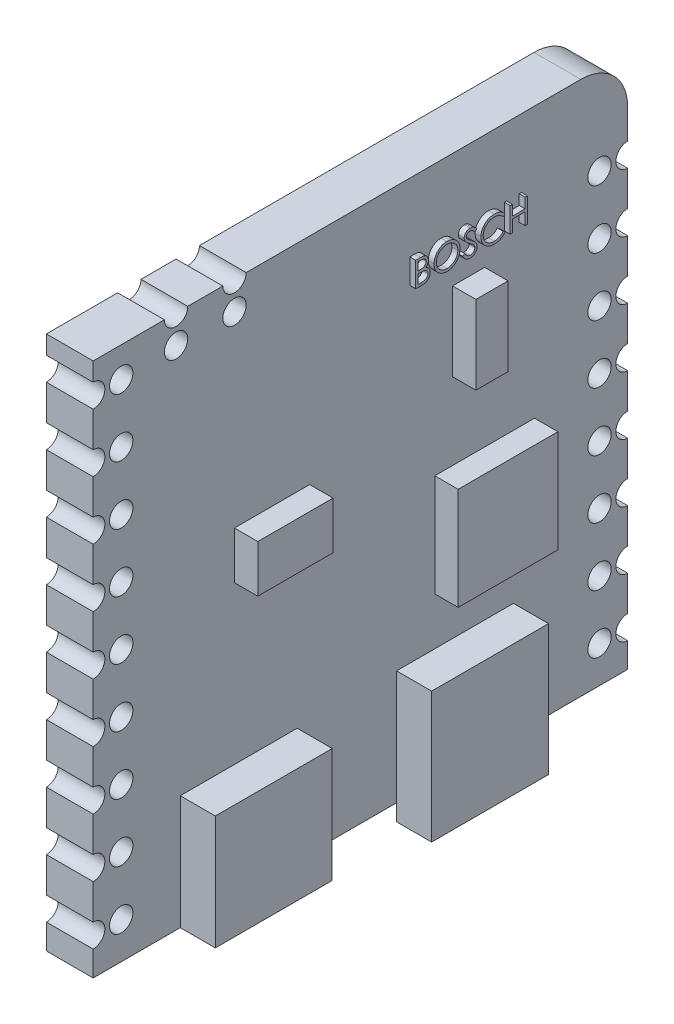
from build123d import *

# Parameters (mm, degrees)
SKETCH2_W                  = 22.86
SKETCH2_H                  = 22.86
BOSS_EXTRUDE1_DEPTH        = 2
FILLET1_R                  = 2
SKETCH3_W                  = 5
SKETCH3_H                  = 4.889030033
SKETCH3_H_2                = 5.593396903
BOSS_EXTRUDE2_DEPTH        = 1.5
SKETCH7_W                  = 0.931523596
SKETCH7_H                  = 4.114229214
CUT_EXTRUDE2_DEPTH         = 5
SKETCH8_W                  = 0.93
SKETCH8_H                  = 3.984850937
CUT_EXTRUDE3_DEPTH         = 4.3
SKETCH9_R                  = 0.5
CUT_EXTRUDE4_DEPTH         = 35.661958731
LPATTERN1_COUNT            = 9
LPATTERN1_PITCH            = 2.5
LPATTERN2_COPY_1_SKETCH_R  = 0.5
LPATTERN2_COPY_1_DEPTH     = 35.661958731
LPATTERN2_COPY_2_SKETCH_R  = 0.5
LPATTERN2_COPY_2_DEPTH     = 35.661958731
LPATTERN2_COPY_3_SKETCH_R  = 0.5
LPATTERN2_COPY_3_DEPTH     = 35.661958731
LPATTERN2_COPY_4_SKETCH_R  = 0.5
LPATTERN2_COPY_4_DEPTH     = 35.661958731
LPATTERN2_COPY_5_SKETCH_R  = 0.5
LPATTERN2_COPY_5_DEPTH     = 35.661958731
LPATTERN2_COPY_6_SKETCH_R  = 0.5
LPATTERN2_COPY_6_DEPTH     = 35.661958731
LPATTERN2_COPY_7_SKETCH_R  = 0.5
LPATTERN2_COPY_7_DEPTH     = 35.661958731
LPATTERN2_COPY_8_SKETCH_R  = 0.5
LPATTERN2_COPY_8_DEPTH     = 35.661958731
LPATTERN2_COPY_9_SKETCH_R  = 0.5
LPATTERN2_COPY_9_DEPTH     = 35.661958731
LPATTERN2_COPY_10_SKETCH_R = 0.5
LPATTERN2_COPY_10_DEPTH    = 35.661958731
LPATTERN2_COPY_11_SKETCH_R = 0.5
LPATTERN2_COPY_11_DEPTH    = 35.661958731
LPATTERN2_COPY_12_SKETCH_R = 0.5
LPATTERN2_COPY_12_DEPTH    = 35.661958731
LPATTERN2_COPY_13_SKETCH_R = 0.5
LPATTERN2_COPY_13_DEPTH    = 35.661958731
LPATTERN2_COPY_14_SKETCH_R = 0.5
LPATTERN2_COPY_14_DEPTH    = 35.661958731
SKETCH10_R                 = 0.5
CUT_EXTRUDE5_DEPTH         = 35.661958731
LPATTERN3_COUNT            = 2
LPATTERN3_PITCH            = 2.5
SKETCH11_W                 = 6.003137578
SKETCH11_H                 = 3.471694022
SKETCH11_W_2               = 1.446539176
SKETCH11_H_2               = 3.110059227
SKETCH11_W_3               = 3.290876625
SKETCH11_H_3               = 2.748424433
SKETCH11_W_4               = 2.712260955
SKETCH11_H_4               = 1.518866134
SKETCH11_H_5               = 1.012577422
SKETCH11_W_5               = 0.759433067
SKETCH11_H_6               = 1.808173969
SKETCH11_W_6               = 1.15723134
SKETCH11_H_7               = 2.35062616
SKETCH11_W_7               = 3.110059227
SKETCH11_H_8               = 1.80817397
BOSS_EXTRUDE3_DEPTH        = 1
SKETCH12_W                 = 3.218549666
SKETCH12_H                 = 2.025154846
SKETCH12_W_2               = 4.267290568
SKETCH12_H_2               = 4.375781007
SKETCH12_W_3               = 1.374212217
SKETCH12_H_3               = 3.363203583
BOSS_EXTRUDE4_DEPTH        = 1
BOSS_EXTRUDE5_DEPTH        = 0.25


with BuildPart() as part:
    # Sketch2 → Boss-Extrude1 (new body)
    with BuildSketch(Plane(origin=(0, 0, 0), x_dir=(0, 0, -1), z_dir=(1, 0, 0))):
        with Locations((11.43, -13.843927591)):
            Rectangle(SKETCH2_W, SKETCH2_H)
    extrude(amount=BOSS_EXTRUDE1_DEPTH)

    # Fillet1
    fillet1_edges = [part.edges().sort_by_distance(p)[0] for p in [
        (1, -2.413927591, -22.86),
    ]]
    fillet(fillet1_edges, radius=FILLET1_R)

    # Sketch3 → Boss-Extrude2 (add)
    with BuildSketch(Plane(origin=(2, 0, 0), x_dir=(0, 0, -1), z_dir=(1, 0, 0))):
        with Locations((6.225887284, -22.829412575)):
            Rectangle(SKETCH3_W, SKETCH3_H)
        with Locations((15.477858262, -23.18159601)):
            Rectangle(SKETCH3_W, SKETCH3_H_2)
    extrude(amount=BOSS_EXTRUDE2_DEPTH)

    # Sketch7 → Cut-Extrude2 (cut)
    with BuildSketch(Plane.XZ.offset(25.978294461)):
        with Locations((2.765761798, -15.534972869)):
            Rectangle(SKETCH7_W, SKETCH7_H)
    extrude(amount=-CUT_EXTRUDE2_DEPTH, mode=Mode.SUBTRACT)

    # Sketch8 → Cut-Extrude3 (cut)
    with BuildSketch(Plane.XZ.offset(25.273927591)):
        with Locations((2.810140075, -6.218312753)):
            Rectangle(SKETCH8_W, SKETCH8_H)
    extrude(amount=-CUT_EXTRUDE3_DEPTH, mode=Mode.SUBTRACT)

    # Sketch9 → Cut-Extrude4 (cut, through all)
    with BuildSketch(Plane(origin=(2, 0, 0), x_dir=(0, 0, -1), z_dir=(1, 0, 0))):
        with Locations((1.2, -23.704030631)):
            Circle(SKETCH9_R)
        with Locations((0, -23.704030631)):
            Circle(SKETCH9_R)
    cut_extrude4 = extrude(amount=-CUT_EXTRUDE4_DEPTH, mode=Mode.SUBTRACT)

    # LPattern1: Cut-Extrude4 ×9
    with Locations(*[(0, i * LPATTERN1_PITCH, 0) for i in range(1, LPATTERN1_COUNT)]):
        add(cut_extrude4, mode=Mode.SUBTRACT)

    # Mirror1: Cut-Extrude4 across plane
    add(cut_extrude4.mirror(Plane.XY.offset(-11.43)), mode=Mode.SUBTRACT)

    # LPattern2 copy 1 sketch → LPattern2 copy 1 (cut, through all)
    with BuildSketch(Plane(origin=(2, 2.5, -22.86), x_dir=(0, 0, 1), z_dir=(1, 0, 0))):
        with Locations((1.2, 23.704030631)):
            Circle(LPATTERN2_COPY_1_SKETCH_R)
        with Locations((0, 23.704030631)):
            Circle(LPATTERN2_COPY_1_SKETCH_R)
    extrude(amount=-LPATTERN2_COPY_1_DEPTH, mode=Mode.SUBTRACT)

    # LPattern2 copy 2 sketch → LPattern2 copy 2 (cut, through all)
    with BuildSketch(Plane(origin=(2, 5, -22.86), x_dir=(0, 0, 1), z_dir=(1, 0, 0))):
        with Locations((1.2, 23.704030631)):
            Circle(LPATTERN2_COPY_2_SKETCH_R)
        with Locations((0, 23.704030631)):
            Circle(LPATTERN2_COPY_2_SKETCH_R)
    extrude(amount=-LPATTERN2_COPY_2_DEPTH, mode=Mode.SUBTRACT)

    # LPattern2 copy 3 sketch → LPattern2 copy 3 (cut, through all)
    with BuildSketch(Plane(origin=(2, 7.5, -22.86), x_dir=(0, 0, 1), z_dir=(1, 0, 0))):
        with Locations((1.2, 23.704030631)):
            Circle(LPATTERN2_COPY_3_SKETCH_R)
        with Locations((0, 23.704030631)):
            Circle(LPATTERN2_COPY_3_SKETCH_R)
    extrude(amount=-LPATTERN2_COPY_3_DEPTH, mode=Mode.SUBTRACT)

    # LPattern2 copy 4 sketch → LPattern2 copy 4 (cut, through all)
    with BuildSketch(Plane(origin=(2, 10, -22.86), x_dir=(0, 0, 1), z_dir=(1, 0, 0))):
        with Locations((1.2, 23.704030631)):
            Circle(LPATTERN2_COPY_4_SKETCH_R)
        with Locations((0, 23.704030631)):
            Circle(LPATTERN2_COPY_4_SKETCH_R)
    extrude(amount=-LPATTERN2_COPY_4_DEPTH, mode=Mode.SUBTRACT)

    # LPattern2 copy 5 sketch → LPattern2 copy 5 (cut, through all)
    with BuildSketch(Plane(origin=(2, 12.5, -22.86), x_dir=(0, 0, 1), z_dir=(1, 0, 0))):
        with Locations((1.2, 23.704030631)):
            Circle(LPATTERN2_COPY_5_SKETCH_R)
        with Locations((0, 23.704030631)):
            Circle(LPATTERN2_COPY_5_SKETCH_R)
    extrude(amount=-LPATTERN2_COPY_5_DEPTH, mode=Mode.SUBTRACT)

    # LPattern2 copy 6 sketch → LPattern2 copy 6 (cut, through all)
    with BuildSketch(Plane(origin=(2, 15, -22.86), x_dir=(0, 0, 1), z_dir=(1, 0, 0))):
        with Locations((1.2, 23.704030631)):
            Circle(LPATTERN2_COPY_6_SKETCH_R)
        with Locations((0, 23.704030631)):
            Circle(LPATTERN2_COPY_6_SKETCH_R)
    extrude(amount=-LPATTERN2_COPY_6_DEPTH, mode=Mode.SUBTRACT)

    # LPattern2 copy 7 sketch → LPattern2 copy 7 (cut, through all)
    with BuildSketch(Plane(origin=(2, 17.5, -22.86), x_dir=(0, 0, 1), z_dir=(1, 0, 0))):
        with Locations((1.2, 23.704030631)):
            Circle(LPATTERN2_COPY_7_SKETCH_R)
        with Locations((0, 23.704030631)):
            Circle(LPATTERN2_COPY_7_SKETCH_R)
    extrude(amount=-LPATTERN2_COPY_7_DEPTH, mode=Mode.SUBTRACT)

    # LPattern2 copy 8 sketch → LPattern2 copy 8 (cut, through all)
    with BuildSketch(Plane(origin=(2, 2.5, 0), x_dir=(0, 0, -1), z_dir=(1, 0, 0))):
        with Locations((1.2, -23.704030631)):
            Circle(LPATTERN2_COPY_8_SKETCH_R)
        with Locations((0, -23.704030631)):
            Circle(LPATTERN2_COPY_8_SKETCH_R)
    extrude(amount=-LPATTERN2_COPY_8_DEPTH, mode=Mode.SUBTRACT)

    # LPattern2 copy 9 sketch → LPattern2 copy 9 (cut, through all)
    with BuildSketch(Plane(origin=(2, 5, 0), x_dir=(0, 0, -1), z_dir=(1, 0, 0))):
        with Locations((1.2, -23.704030631)):
            Circle(LPATTERN2_COPY_9_SKETCH_R)
        with Locations((0, -23.704030631)):
            Circle(LPATTERN2_COPY_9_SKETCH_R)
    extrude(amount=-LPATTERN2_COPY_9_DEPTH, mode=Mode.SUBTRACT)

    # LPattern2 copy 10 sketch → LPattern2 copy 10 (cut, through all)
    with BuildSketch(Plane(origin=(2, 7.5, 0), x_dir=(0, 0, -1), z_dir=(1, 0, 0))):
        with Locations((1.2, -23.704030631)):
            Circle(LPATTERN2_COPY_10_SKETCH_R)
        with Locations((0, -23.704030631)):
            Circle(LPATTERN2_COPY_10_SKETCH_R)
    extrude(amount=-LPATTERN2_COPY_10_DEPTH, mode=Mode.SUBTRACT)

    # LPattern2 copy 11 sketch → LPattern2 copy 11 (cut, through all)
    with BuildSketch(Plane(origin=(2, 10, 0), x_dir=(0, 0, -1), z_dir=(1, 0, 0))):
        with Locations((1.2, -23.704030631)):
            Circle(LPATTERN2_COPY_11_SKETCH_R)
        with Locations((0, -23.704030631)):
            Circle(LPATTERN2_COPY_11_SKETCH_R)
    extrude(amount=-LPATTERN2_COPY_11_DEPTH, mode=Mode.SUBTRACT)

    # LPattern2 copy 12 sketch → LPattern2 copy 12 (cut, through all)
    with BuildSketch(Plane(origin=(2, 12.5, 0), x_dir=(0, 0, -1), z_dir=(1, 0, 0))):
        with Locations((1.2, -23.704030631)):
            Circle(LPATTERN2_COPY_12_SKETCH_R)
        with Locations((0, -23.704030631)):
            Circle(LPATTERN2_COPY_12_SKETCH_R)
    extrude(amount=-LPATTERN2_COPY_12_DEPTH, mode=Mode.SUBTRACT)

    # LPattern2 copy 13 sketch → LPattern2 copy 13 (cut, through all)
    with BuildSketch(Plane(origin=(2, 15, 0), x_dir=(0, 0, -1), z_dir=(1, 0, 0))):
        with Locations((1.2, -23.704030631)):
            Circle(LPATTERN2_COPY_13_SKETCH_R)
        with Locations((0, -23.704030631)):
            Circle(LPATTERN2_COPY_13_SKETCH_R)
    extrude(amount=-LPATTERN2_COPY_13_DEPTH, mode=Mode.SUBTRACT)

    # LPattern2 copy 14 sketch → LPattern2 copy 14 (cut, through all)
    with BuildSketch(Plane(origin=(2, 17.5, 0), x_dir=(0, 0, -1), z_dir=(1, 0, 0))):
        with Locations((1.2, -23.704030631)):
            Circle(LPATTERN2_COPY_14_SKETCH_R)
        with Locations((0, -23.704030631)):
            Circle(LPATTERN2_COPY_14_SKETCH_R)
    extrude(amount=-LPATTERN2_COPY_14_DEPTH, mode=Mode.SUBTRACT)

    # Sketch10 → Cut-Extrude5 (cut, through all)
    with BuildSketch(Plane(origin=(2, 0, 0), x_dir=(0, 0, -1), z_dir=(1, 0, 0))):
        with Locations((3.546361493, -3.613927591)):
            Circle(SKETCH10_R)
        with Locations((3.546361493, -2.413927591)):
            Circle(SKETCH10_R)
    cut_extrude5 = extrude(amount=-CUT_EXTRUDE5_DEPTH, mode=Mode.SUBTRACT)

    # LPattern3: Cut-Extrude5 ×2
    with Locations(*[(0, 0, -i * LPATTERN3_PITCH) for i in range(1, LPATTERN3_COUNT)]):
        add(cut_extrude5, mode=Mode.SUBTRACT)

    # Sketch11 → Boss-Extrude3 (add)
    with BuildSketch(Plane.ZY):
        with Locations((-15.046347939, -5.477637019)):
            Rectangle(SKETCH11_W, SKETCH11_H)
        with Locations((-15.154838377, -11.408447639)):
            Rectangle(SKETCH11_W_2, SKETCH11_H_2)
        with Locations((-6.421358105, -22.438308853)):
            Rectangle(SKETCH11_W_3, SKETCH11_H_3)
        with Locations((-6.13205027, -7.647445782)):
            Rectangle(SKETCH11_W_4, SKETCH11_H_4)
        with Locations((-15.154838377, -14.771651222)):
            Rectangle(SKETCH11_W_2, SKETCH11_H_5)
        with Locations((-15.064429679, -17.520075656)):
            Rectangle(SKETCH11_W_5, SKETCH11_H_6)
        with Locations((-5.137554586, -15.440675591)):
            Rectangle(SKETCH11_W_6, SKETCH11_H_7)
        with Locations((-9.621826031, -10.504360654)):
            Rectangle(SKETCH11_W_7, SKETCH11_H_8)
    extrude(amount=BOSS_EXTRUDE3_DEPTH)

    # Sketch12 → Boss-Extrude4 (add)
    with BuildSketch(Plane(origin=(2, 0, 0), x_dir=(0, 0, -1), z_dir=(1, 0, 0))):
        with Locations((7.650916404, -12.638005938)):
            Rectangle(SKETCH12_W, SKETCH12_H)
        with Locations((16.74603147, -16.163945179)):
            Rectangle(SKETCH12_W_2, SKETCH12_H_2)
        with Locations((16.058925362, -9.00357626)):
            Rectangle(SKETCH12_W_3, SKETCH12_H_3)
    extrude(amount=BOSS_EXTRUDE4_DEPTH)

    # Sketch13 → Boss-Extrude5 (add)
    # profile 1 of 5: a face of its own
    with BuildSketch(Plane(origin=(2, 0, 0), x_dir=(0, 0, -1), z_dir=(1, 0, 0))):
        with BuildLine():
            Line((13.544549353, -5.333516444), (13.751043076, -5.333516444))
            add(Edge.make_bspline(
                [(13.751043076, -5.333516444), (13.761151211, -5.333569588), (13.780743293, -5.333672594), (13.809233457, -5.335270112), (13.835918217, -5.337448364), (13.86080531, -5.340904607), (13.883883236, -5.345074977), (13.905221546, -5.350125288), (13.924752384, -5.356180955), (13.948069806, -5.365810664), (13.974655339, -5.380120288), (14.00344152, -5.401265355), (14.028056611, -5.427128742), (14.049279617, -5.456303259), (14.066152813, -5.488396695), (14.078359719, -5.522644117), (14.086087934, -5.558603786), (14.086882722, -5.583291128), (14.087284396, -5.595767713)],
                knots=[0, 0, 0, 0, 1.001505555, 1.941167018, 2.826882275, 3.653841531, 4.429895133, 5.150066043, 5.825578002, 6.45369114, 7.647487171, 8.808567382, 9.977351308, 11.170798116, 12.373658725, 13.556498008, 14.765093433, 16, 16, 16, 16], degree=3))
            add(Edge.make_bspline(
                [(14.087284396, -5.595767713), (14.086953827, -5.60745551), (14.086304229, -5.630423132), (14.08009249, -5.664015875), (14.070367716, -5.695993029), (14.056849701, -5.726237893), (14.039280764, -5.754067105), (14.01845932, -5.779705159), (13.993338477, -5.80206655), (13.974517307, -5.814567856), (13.964957005, -5.820917954)],
                knots=[0, 0, 0, 0, 1.044552857, 2.05264487, 3.044412934, 4.028983338, 5.005914585, 5.980388656, 6.974128949, 8, 8, 8, 8], degree=3))
            add(Edge.make_bspline(
                [(13.964957005, -5.820917954), (13.976979801, -5.825533798), (13.999982388, -5.834365053), (14.031637444, -5.849978634), (14.058910647, -5.866960986), (14.082011689, -5.88550657), (14.101768551, -5.905496615), (14.119020274, -5.927224233), (14.133740594, -5.950972857), (14.146353788, -5.976494879), (14.156195912, -6.003529692), (14.163566721, -6.031823712), (14.167790212, -6.061275482), (14.168391237, -6.081318918), (14.168694652, -6.091437451)],
                knots=[0, 0, 0, 0, 1.27268992, 2.434971085, 3.483601985, 4.442670788, 5.356604649, 6.2567628, 7.179492994, 8.113709626, 9.066344395, 10.018646069, 10.999752585, 12, 12, 12, 12], degree=3))
            add(Edge.make_bspline(
                [(14.168694652, -6.091437451), (14.168399272, -6.101768863), (14.167818105, -6.122096204), (14.163530351, -6.151957876), (14.156270455, -6.180495062), (14.14627037, -6.207892343), (14.133218908, -6.234096717), (14.117335452, -6.259137871), (14.09839686, -6.282764204), (14.077211183, -6.305238252), (14.05324382, -6.325445702), (14.027385485, -6.343442118), (13.999310526, -6.358242475), (13.969480042, -6.370675177), (13.937559404, -6.380172115), (13.903691949, -6.386816203), (13.867906886, -6.391292964), (13.843350604, -6.391661024), (13.830757286, -6.391849778)],
                knots=[0, 0, 0, 0, 0.978564426, 1.925352924, 2.850884081, 3.763762016, 4.682927383, 5.618979971, 6.567305752, 7.547517671, 8.540179244, 9.531824382, 10.526200242, 11.540722885, 12.589160233, 13.674978461, 14.80764778, 16, 16, 16, 16], degree=3))
            Line((13.830757286, -6.391849778), (13.544549353, -6.391849778))
            Line((13.544549353, -6.391849778), (13.544549353, -5.333516444))
        make_face()
        with BuildLine():
            Line((13.639527985, -5.442063453), (13.639527985, -5.781272855))
            Line((13.639527985, -5.781272855), (13.703341754, -5.781272855))
            add(Edge.make_bspline(
                [(13.703341754, -5.781272855), (13.712669842, -5.781151926), (13.730693609, -5.780918266), (13.756795102, -5.780248941), (13.781023381, -5.77837477), (13.803336626, -5.776501139), (13.823699698, -5.773454775), (13.842067485, -5.769828586), (13.858728251, -5.765993517), (13.8779414, -5.759471315), (13.899734886, -5.749832113), (13.922967754, -5.734872772), (13.943449367, -5.71705517), (13.960744707, -5.696495998), (13.974899604, -5.67385789), (13.984731132, -5.649502047), (13.991397811, -5.624035484), (13.992000012, -5.606552345), (13.992305763, -5.597675766)],
                knots=[0, 0, 0, 0, 1.156816544, 2.235205308, 3.236616184, 4.169592532, 5.011045266, 5.787822928, 6.49130361, 7.128639758, 8.301311294, 9.436451833, 10.541879658, 11.654887649, 12.756523258, 13.837046038, 14.901820046, 16, 16, 16, 16], degree=3))
            add(Edge.make_bspline(
                [(13.992305763, -5.597675766), (13.992146656, -5.591801783), (13.991834551, -5.580279323), (13.989278433, -5.563482256), (13.984933952, -5.547684741), (13.979353725, -5.532670284), (13.971555717, -5.518908367), (13.962374384, -5.505923163), (13.95128133, -5.494156879), (13.938654714, -5.483159436), (13.924137821, -5.473409305), (13.907739312, -5.464869836), (13.889237324, -5.457993458), (13.868943675, -5.451971193), (13.846545989, -5.447741399), (13.822302731, -5.444217637), (13.796015328, -5.442423689), (13.777828594, -5.44218621), (13.768427558, -5.442063453)],
                knots=[0, 0, 0, 0, 0.91205012, 1.789085906, 2.630437955, 3.453916878, 4.269457761, 5.079663411, 5.91843418, 6.774407191, 7.675494373, 8.627863946, 9.638891023, 10.736472738, 11.911756761, 13.175263542, 14.539845004, 16, 16, 16, 16], degree=3))
            Line((13.768427558, -5.442063453), (13.639527985, -5.442063453))
        make_face(mode=Mode.SUBTRACT)
        with BuildLine():
            Line((13.639527985, -5.889819863), (13.639527985, -6.283302769))
            Line((13.639527985, -6.283302769), (13.774787734, -6.283302769))
            add(Edge.make_bspline(
                [(13.774787734, -6.283302769), (13.784469648, -6.283186731), (13.803130259, -6.282963084), (13.830072774, -6.282232968), (13.855044332, -6.280572209), (13.877930982, -6.277957868), (13.898979857, -6.275122004), (13.917938448, -6.271308593), (13.934960438, -6.266939502), (13.954698145, -6.260186074), (13.976924206, -6.249694522), (14.00087606, -6.233875697), (14.022171607, -6.215030316), (14.040255578, -6.193219301), (14.055076172, -6.169503162), (14.065857703, -6.144361592), (14.072507319, -6.118210015), (14.073312308, -6.100379605), (14.07371602, -6.091437451)],
                knots=[0, 0, 0, 0, 1.160039823, 2.235823828, 3.228722157, 4.157150951, 4.99529583, 5.772374946, 6.472645482, 7.099169577, 8.269452708, 9.405989375, 10.527446681, 11.663510218, 12.788923519, 13.866172445, 14.929861265, 16, 16, 16, 16], degree=3))
            add(Edge.make_bspline(
                [(14.07371602, -6.091437451), (14.073632531, -6.085845417), (14.0734669, -6.07475155), (14.070969048, -6.058448433), (14.067336282, -6.042656324), (14.062639872, -6.02733234), (14.055800176, -6.012753534), (14.04781534, -5.998631569), (14.038453202, -5.984947779), (14.023865085, -5.967647883), (14.002646414, -5.947715834), (13.972496984, -5.928200923), (13.938215361, -5.912462657), (13.913351333, -5.905780196), (13.900507219, -5.90232821)],
                knots=[0, 0, 0, 0, 0.723448775, 1.435228256, 2.130040452, 2.821711965, 3.505591119, 4.210454504, 4.921174351, 5.648778258, 7.137944449, 8.670945889, 10.280296675, 12, 12, 12, 12], degree=3))
            add(Edge.make_bspline(
                [(13.900507219, -5.90232821), (13.895357945, -5.901283458), (13.884193256, -5.899018221), (13.86598763, -5.896627083), (13.845203213, -5.894496791), (13.82179201, -5.892921036), (13.7957244, -5.891292248), (13.766944713, -5.890658814), (13.735570478, -5.889903085), (13.713801355, -5.889848313), (13.702493731, -5.889819863)],
                knots=[0, 0, 0, 0, 0.634451884, 1.375622551, 2.216452059, 3.157844607, 4.20941857, 5.370758133, 6.634282058, 8, 8, 8, 8], degree=3))
            Line((13.702493731, -5.889819863), (13.639527985, -5.889819863))
        make_face(mode=Mode.SUBTRACT)
    # profile 2 of 5: a face of its own
    with BuildSketch(Plane(origin=(2, 0, 0), x_dir=(0, 0, -1), z_dir=(1, 0, 0))):
        with BuildLine():
            add(Edge.make_bspline(
                [(14.881034396, -5.306379692), (14.900631132, -5.306876044), (14.93912074, -5.307850921), (14.995688626, -5.315313412), (15.049692381, -5.328223684), (15.101571923, -5.345417967), (15.150706704, -5.368354888), (15.19746656, -5.396078731), (15.241740233, -5.428879946), (15.282930984, -5.466504974), (15.320624872, -5.507442352), (15.353834128, -5.55112972), (15.381665964, -5.597302929), (15.404521667, -5.645823228), (15.422452437, -5.696580885), (15.434825576, -5.7498465), (15.442729255, -5.805274951), (15.443653264, -5.843080694), (15.444122002, -5.862259099)],
                knots=[0, 0, 0, 0, 1.065120563, 2.091984664, 3.0946048, 4.079830382, 5.057816894, 6.036188127, 7.030412546, 8.04752943, 9.064399622, 10.05169764, 11.02544977, 11.989514704, 12.962713494, 13.945757189, 14.957906945, 16, 16, 16, 16], degree=3))
            add(Edge.make_bspline(
                [(15.444122002, -5.862259099), (15.443653332, -5.881296232), (15.442729529, -5.918820626), (15.43481659, -5.973897334), (15.422406573, -6.026841425), (15.404688178, -6.077564516), (15.381941426, -6.126120112), (15.353924267, -6.172380453), (15.320922044, -6.216360704), (15.283364258, -6.257579057), (15.242421562, -6.295375912), (15.198506696, -6.328310905), (15.152607287, -6.356651295), (15.104132685, -6.379264454), (15.053725769, -6.397338344), (15.0009354, -6.409661163), (14.946008942, -6.417609864), (14.90855271, -6.418522606), (14.889514631, -6.41898653)],
                knots=[0, 0, 0, 0, 1.043624062, 2.057103931, 3.04512605, 4.022047818, 4.998200453, 5.980619268, 6.982898556, 8.009068085, 9.034988726, 10.034168286, 11.015286542, 11.987931943, 12.962482838, 13.94673481, 14.956375938, 16, 16, 16, 16], degree=3))
            add(Edge.make_bspline(
                [(14.889514631, -6.41898653), (14.870336325, -6.418518025), (14.832530778, -6.417594477), (14.777032675, -6.409677719), (14.723729643, -6.397297848), (14.672774113, -6.379605709), (14.62413767, -6.356740499), (14.577725192, -6.328859651), (14.533722974, -6.295777015), (14.492495827, -6.258231408), (14.454774046, -6.217358106), (14.421887282, -6.173562986), (14.394000164, -6.127705264), (14.371211728, -6.07965768), (14.353170332, -6.029652505), (14.34086197, -5.97735618), (14.33289848, -5.923066853), (14.3319808, -5.886102929), (14.331515165, -5.86734724)],
                knots=[0, 0, 0, 0, 1.053102029, 2.075944431, 3.073151272, 4.055350789, 5.033113405, 6.020478099, 7.024410459, 8.052272461, 9.079885166, 10.07527673, 11.055994387, 12.023226415, 12.992069828, 13.970394897, 14.97016774, 16, 16, 16, 16], degree=3))
            add(Edge.make_bspline(
                [(14.331515165, -5.86734724), (14.331676828, -5.854758314), (14.331998116, -5.829739277), (14.33586608, -5.792586757), (14.341478785, -5.756031725), (14.349522697, -5.720178129), (14.360043034, -5.685113736), (14.372456385, -5.65059672), (14.38761772, -5.616976879), (14.404756868, -5.584094949), (14.423886034, -5.552463511), (14.445015129, -5.522564208), (14.467402015, -5.494146145), (14.491944279, -5.467945741), (14.517833061, -5.443200802), (14.545488333, -5.4202916), (14.574741345, -5.399011555), (14.605717969, -5.379834452), (14.637654923, -5.362490142), (14.670577187, -5.347606392), (14.704037627, -5.334831988), (14.738192961, -5.324478214), (14.772952489, -5.316304242), (14.808392077, -5.310738209), (14.844483489, -5.306860379), (14.86879834, -5.306540611), (14.881034396, -5.306379692)],
                knots=[0, 0, 0, 0, 1.037015668, 2.060948919, 3.074880161, 4.083647147, 5.086022904, 6.090072063, 7.104153813, 8.122640571, 9.144368836, 10.147691507, 11.138137339, 12.123020368, 13.103399296, 14.087645067, 15.080126199, 16.082011238, 17.087798457, 18.072939717, 19.057185487, 20.037253025, 21.01195951, 21.997135196, 22.992090687, 24, 24, 24, 24], degree=3))
        make_face()
        with BuildLine():
            add(Edge.make_bspline(
                [(14.885698525, -5.414926701), (14.875655052, -5.415049132), (14.855664124, -5.415292824), (14.825944752, -5.418502814), (14.796616239, -5.423077804), (14.767672527, -5.429603645), (14.73923472, -5.43849487), (14.711037744, -5.448727716), (14.683338726, -5.461192189), (14.656229107, -5.475274888), (14.629947644, -5.4908623), (14.605148565, -5.508089477), (14.58176767, -5.526552421), (14.559862206, -5.546294219), (14.539496495, -5.567415408), (14.520269692, -5.589595788), (14.502952461, -5.613469336), (14.487081823, -5.638388673), (14.472879642, -5.664321342), (14.460250595, -5.690994324), (14.449920049, -5.718625196), (14.441494997, -5.746914191), (14.434510054, -5.775816506), (14.430085034, -5.805551394), (14.426839773, -5.835969439), (14.426610011, -5.856525857), (14.426493797, -5.866923229)],
                knots=[0, 0, 0, 0, 1.008559885, 2.007477868, 2.99961109, 3.989939068, 4.984837346, 5.991145699, 7.001802488, 8.033829008, 9.059044045, 10.069351652, 11.065060232, 12.050310815, 13.029377138, 14.011219647, 14.996725999, 15.989392538, 16.977580475, 17.965360261, 18.951710183, 19.937753436, 20.929683414, 21.935841486, 22.955955122, 24, 24, 24, 24], degree=3))
            add(Edge.make_bspline(
                [(14.426493797, -5.866923229), (14.426879291, -5.882212281), (14.427637677, -5.912290577), (14.434277228, -5.956368087), (14.444504349, -5.998728117), (14.459580267, -6.039138885), (14.478433905, -6.077947751), (14.50172537, -6.11481044), (14.529320379, -6.149736914), (14.560666255, -6.18248334), (14.594932883, -6.212372429), (14.631319208, -6.238608031), (14.669435418, -6.260805892), (14.70938091, -6.278889807), (14.750942428, -6.293219561), (14.794387783, -6.30304048), (14.839427565, -6.309504011), (14.870128501, -6.310124725), (14.885698525, -6.310439521)],
                knots=[0, 0, 0, 0, 1.032063989, 2.030389145, 3.003944642, 3.970395727, 4.937377036, 5.913328081, 6.909231446, 7.93887556, 8.970685674, 9.976071282, 10.964166581, 11.944589148, 12.933237628, 13.927779006, 14.949070134, 16, 16, 16, 16], degree=3))
            add(Edge.make_bspline(
                [(14.885698525, -6.310439521), (14.896163779, -6.310295738), (14.916919521, -6.310010572), (14.947791262, -6.307138353), (14.978106831, -6.302532526), (15.007823706, -6.295901113), (15.036908161, -6.287601601), (15.06548159, -6.277741645), (15.093239644, -6.265440424), (15.1205325, -6.25184902), (15.146657078, -6.236354972), (15.171596108, -6.219712484), (15.194720987, -6.201276734), (15.216610064, -6.181828253), (15.237059389, -6.160974899), (15.255930677, -6.138743784), (15.273160383, -6.114994586), (15.289024995, -6.090113046), (15.303177411, -6.064109417), (15.315508233, -6.037339729), (15.32596944, -6.009869898), (15.334414488, -5.981660304), (15.341032234, -5.952764524), (15.345592115, -5.923143867), (15.348781762, -5.892857589), (15.349022178, -5.872373138), (15.34914337, -5.862047093)],
                knots=[0, 0, 0, 0, 1.047197238, 2.076906641, 3.100256066, 4.114471768, 5.12198147, 6.126382909, 7.136867548, 8.15857795, 9.17633901, 10.174870724, 11.156907918, 12.133735059, 13.104061851, 14.077631395, 15.04955518, 16.038496417, 17.029181396, 18.010275684, 18.986308667, 19.968651475, 20.955262928, 21.950658345, 22.966943676, 24, 24, 24, 24], degree=3))
            add(Edge.make_bspline(
                [(15.34914337, -5.862047093), (15.349022081, -5.851791691), (15.348781482, -5.831448211), (15.345593639, -5.801373154), (15.341027417, -5.771965635), (15.334446789, -5.743341104), (15.325964956, -5.715492265), (15.315506407, -5.688445272), (15.303173709, -5.662099365), (15.289019793, -5.636519661), (15.273109771, -5.611973967), (15.255724606, -5.588508475), (15.236564132, -5.566563861), (15.216175787, -5.54559837), (15.194050305, -5.526059151), (15.170287911, -5.507939722), (15.145177085, -5.490802803), (15.118589563, -5.475343407), (15.09115032, -5.461066723), (15.062994433, -5.44883511), (15.034440872, -5.438441636), (15.005562247, -5.429576744), (14.97611549, -5.423103363), (14.94629957, -5.418498691), (14.916155739, -5.415293941), (14.895883147, -5.415049503), (14.885698525, -5.414926701)],
                knots=[0, 0, 0, 0, 1.02996197, 2.043119294, 3.035359645, 4.018872909, 4.991431989, 5.957985074, 6.929999688, 7.912076566, 8.892894881, 9.867085534, 10.843653904, 11.817741046, 12.803660682, 13.806313499, 14.818574707, 15.856120519, 16.894564902, 17.924820532, 18.937903209, 19.946497019, 20.957711757, 21.963978472, 22.977135795, 24, 24, 24, 24], degree=3))
        make_face(mode=Mode.SUBTRACT)
    # profile 3 of 5: a face of its own
    with BuildSketch(Plane(origin=(2, 0, 0), x_dir=(0, 0, -1), z_dir=(1, 0, 0))):
        with BuildLine():
            Line((15.552669011, -6.187688119), (15.642135491, -6.134050632))
            add(Edge.make_bspline(
                [(15.642135491, -6.134050632), (15.650456481, -6.147979625), (15.666399179, -6.174667037), (15.692993994, -6.210728397), (15.720550851, -6.241378383), (15.749273816, -6.26643869), (15.778987567, -6.286168711), (15.809886079, -6.300139386), (15.841865226, -6.308852788), (15.863628739, -6.309911147), (15.874493931, -6.310439521)],
                knots=[0, 0, 0, 0, 1.272034388, 2.437168799, 3.508375237, 4.49857839, 5.41946034, 6.295179144, 7.148887113, 8, 8, 8, 8], degree=3))
            add(Edge.make_bspline(
                [(15.874493931, -6.310439521), (15.883773053, -6.310181085), (15.902168934, -6.309668733), (15.929250851, -6.304745729), (15.955552491, -6.297182538), (15.980531769, -6.28635097), (16.003844015, -6.273246238), (16.024286992, -6.257417751), (16.041959983, -6.23969635), (16.056416549, -6.219925881), (16.067507893, -6.198663315), (16.076032637, -6.176838682), (16.080763409, -6.154109138), (16.081476047, -6.138805498), (16.081835678, -6.13108255)],
                knots=[0, 0, 0, 0, 1.095163259, 2.171163733, 3.241058638, 4.321873601, 5.38011039, 6.391990106, 7.366004449, 8.327778327, 9.272591725, 10.192022065, 11.087607919, 12, 12, 12, 12], degree=3))
            add(Edge.make_bspline(
                [(16.081835678, -6.13108255), (16.081389874, -6.122270912), (16.080483621, -6.10435814), (16.072823864, -6.07793015), (16.060774211, -6.051776444), (16.049657887, -6.035598681), (16.043886626, -6.027199671)],
                knots=[0, 0, 0, 0, 0.938893495, 1.908633276, 2.914225137, 4, 4, 4, 4], degree=3))
            add(Edge.make_bspline(
                [(16.043886626, -6.027199671), (16.039148131, -6.021137893), (16.029200253, -6.008411949), (16.012098338, -5.989469224), (15.992030489, -5.969929844), (15.969683462, -5.949047701), (15.944243218, -5.92779401), (15.916506565, -5.905155269), (15.885765351, -5.881992411), (15.864205741, -5.866458326), (15.853081337, -5.858442994)],
                knots=[0, 0, 0, 0, 0.722233717, 1.516239348, 2.393582979, 3.351407094, 4.387010283, 5.505090956, 6.712668013, 8, 8, 8, 8], degree=3))
            add(Edge.make_bspline(
                [(15.853081337, -5.858442994), (15.841946462, -5.850511968), (15.820657429, -5.835348452), (15.790885429, -5.812843966), (15.764262461, -5.792268796), (15.740906853, -5.773429249), (15.72082888, -5.756322771), (15.703870325, -5.741113633), (15.69046319, -5.727390508), (15.683007812, -5.718488007), (15.679660531, -5.714491004)],
                knots=[0, 0, 0, 0, 1.452282411, 2.77665338, 3.964542531, 5.026858415, 5.96415736, 6.766646006, 7.446254459, 8, 8, 8, 8], degree=3))
            add(Edge.make_bspline(
                [(15.679660531, -5.714491004), (15.674981928, -5.708261643), (15.665780827, -5.696010768), (15.653635392, -5.676862537), (15.64331236, -5.657261216), (15.63521994, -5.637154134), (15.628405417, -5.616823572), (15.623821947, -5.596004266), (15.62095193, -5.574789637), (15.620658019, -5.560513173), (15.620510891, -5.553366538)],
                knots=[0, 0, 0, 0, 1.068054152, 2.10047183, 3.106115577, 4.101338837, 5.06977816, 6.043150881, 7.020423561, 8, 8, 8, 8], degree=3))
            add(Edge.make_bspline(
                [(15.620510891, -5.553366538), (15.620905562, -5.542169439), (15.621686467, -5.520014573), (15.628290623, -5.487650488), (15.638714569, -5.456751262), (15.653318024, -5.427622804), (15.672143461, -5.401023567), (15.693928792, -5.376647584), (15.719876551, -5.356155655), (15.74834651, -5.338251057), (15.779508794, -5.324236932), (15.812163187, -5.313665397), (15.846361587, -5.307675455), (15.869524916, -5.306815857), (15.881278119, -5.306379692)],
                knots=[0, 0, 0, 0, 1.005424448, 1.989358655, 2.955360095, 3.929531133, 4.905563448, 5.876582895, 6.856512386, 7.866279853, 8.892233794, 9.918561126, 10.94386622, 12, 12, 12, 12], degree=3))
            add(Edge.make_bspline(
                [(15.881278119, -5.306379692), (15.893749549, -5.306809845), (15.918551244, -5.307665281), (15.955033268, -5.315103106), (15.990158056, -5.327410214), (16.01841352, -5.341376784), (16.040527474, -5.355326046), (16.057392086, -5.36803204), (16.074481887, -5.382659751), (16.091934727, -5.399248142), (16.109454879, -5.417949422), (16.127302446, -5.438635511), (16.145519166, -5.461179994), (16.1572382, -5.477274069), (16.163245934, -5.485524658)],
                knots=[0, 0, 0, 0, 1.286793592, 2.559021753, 3.825965368, 5.121522368, 5.803751409, 6.523245864, 7.299691795, 8.125521123, 9.008227632, 9.944561021, 10.946284179, 12, 12, 12, 12], degree=3))
            Line((16.163245934, -5.485524658), (16.077383554, -5.550610462))
            add(Edge.make_bspline(
                [(16.077383554, -5.550610462), (16.072198951, -5.543931262), (16.062214617, -5.531068686), (16.047056415, -5.513055455), (16.032769324, -5.496600948), (16.01869337, -5.482308874), (16.005571962, -5.469396562), (15.992836571, -5.458341588), (15.980670469, -5.449035634), (15.965334641, -5.439104367), (15.946067617, -5.429259901), (15.921881817, -5.420929584), (15.896606919, -5.415923649), (15.879392483, -5.415261771), (15.870677825, -5.414926701)],
                knots=[0, 0, 0, 0, 1.181633172, 2.275549214, 3.290209073, 4.226197932, 5.078386478, 5.862611352, 6.581680152, 7.217281963, 8.414376989, 9.595101626, 10.782541182, 12, 12, 12, 12], degree=3))
            add(Edge.make_bspline(
                [(15.870677825, -5.414926701), (15.859744781, -5.415293096), (15.838661437, -5.415999654), (15.808728675, -5.423716412), (15.781788369, -5.435866641), (15.758640331, -5.452895217), (15.739367483, -5.473070375), (15.725426071, -5.496286838), (15.71703495, -5.521923422), (15.716011003, -5.539806732), (15.715489524, -5.548914415)],
                knots=[0, 0, 0, 0, 1.14458467, 2.207223713, 3.21896685, 4.227309161, 5.202851033, 6.127160689, 7.046193047, 8, 8, 8, 8], degree=3))
            add(Edge.make_bspline(
                [(15.715489524, -5.548914415), (15.715608398, -5.554584504), (15.71584634, -5.565933956), (15.71916491, -5.58270141), (15.723428279, -5.599426505), (15.730184265, -5.616034048), (15.739511297, -5.632814485), (15.751759291, -5.650056773), (15.767184745, -5.667912885), (15.779000889, -5.679526543), (15.785239457, -5.685658205)],
                knots=[0, 0, 0, 0, 0.858281714, 1.717966888, 2.583508476, 3.4729293, 4.427298488, 5.488583878, 6.674047936, 8, 8, 8, 8], degree=3))
            add(Edge.make_bspline(
                [(15.785239457, -5.685658205), (15.78755611, -5.687725591), (15.793059948, -5.692637228), (15.803121954, -5.700678227), (15.816409419, -5.71059716), (15.83257537, -5.722869992), (15.851917882, -5.737106529), (15.874439081, -5.753124741), (15.899887926, -5.771444629), (15.917946695, -5.784252743), (15.9274954, -5.791025125)],
                knots=[0, 0, 0, 0, 0.420754252, 0.999615792, 1.744751191, 2.668019286, 3.750313428, 4.999500688, 6.413464383, 8, 8, 8, 8], degree=3))
            add(Edge.make_bspline(
                [(15.9274954, -5.791025125), (15.938981617, -5.799383346), (15.961223083, -5.815567881), (15.992869542, -5.839884051), (16.021563622, -5.863665639), (16.047406067, -5.886760772), (16.07065218, -5.908994267), (16.091044062, -5.93063361), (16.108789494, -5.951523771), (16.127893686, -5.978306431), (16.147414741, -6.011199758), (16.164179197, -6.051500559), (16.174749935, -6.091958018), (16.176132274, -6.11915018), (16.17681431, -6.132566591)],
                knots=[0, 0, 0, 0, 1.163667725, 2.253281268, 3.268753668, 4.215851969, 5.092017293, 5.902905408, 6.650798638, 7.335211899, 8.59617414, 9.77448103, 10.901945474, 12, 12, 12, 12], degree=3))
            add(Edge.make_bspline(
                [(16.17681431, -6.132566591), (16.176615604, -6.142054811), (16.176222051, -6.160846996), (16.171698155, -6.188440793), (16.165070066, -6.21524108), (16.155080236, -6.240916583), (16.142887281, -6.265937023), (16.127415582, -6.289646079), (16.109482068, -6.31256849), (16.088909953, -6.334093022), (16.06639893, -6.353852467), (16.04260648, -6.371429588), (16.017493659, -6.386085486), (15.991196702, -6.398044907), (15.963709567, -6.407398613), (15.935041499, -6.414175838), (15.905145242, -6.418335303), (15.884825096, -6.418767031), (15.874493931, -6.41898653)],
                knots=[0, 0, 0, 0, 0.983748083, 1.948392443, 2.894712957, 3.844097841, 4.80183111, 5.778335162, 6.776009319, 7.81870978, 8.863265674, 9.881300176, 10.883814829, 11.87499822, 12.874611388, 13.892143829, 14.928324115, 16, 16, 16, 16], degree=3))
            add(Edge.make_bspline(
                [(15.874493931, -6.41898653), (15.866500387, -6.418831958), (15.850613969, -6.418524762), (15.827116102, -6.415808994), (15.80409294, -6.411966608), (15.781833383, -6.405866353), (15.760050642, -6.398464982), (15.738839455, -6.389351724), (15.718189541, -6.37843057), (15.697985176, -6.365943741), (15.678277747, -6.351411995), (15.659252099, -6.334486675), (15.640283988, -6.315634582), (15.621933275, -6.294343769), (15.603828777, -6.270958206), (15.586327448, -6.245259096), (15.569067024, -6.21738642), (15.558237109, -6.197772453), (15.552669011, -6.187688119)],
                knots=[0, 0, 0, 0, 0.915332311, 1.819136955, 2.706846663, 3.586547465, 4.459518054, 5.340707479, 6.227863349, 7.133153174, 8.059268498, 9.028702269, 10.047606654, 11.120612155, 12.245963614, 13.433783089, 14.680604001, 16, 16, 16, 16], degree=3))
        make_face()
    # profile 4 of 5: a face of its own
    with BuildSketch(Plane(origin=(2, 0, 0), x_dir=(0, 0, -1), z_dir=(1, 0, 0))):
        with BuildLine():
            Line((17.370831404, -5.527713827), (17.287725101, -5.59131559))
            add(Edge.make_bspline(
                [(17.287725101, -5.59131559), (17.281796654, -5.584250166), (17.270019687, -5.570214574), (17.251072738, -5.550505522), (17.231326765, -5.53204055), (17.210789317, -5.514731696), (17.189090726, -5.499184245), (17.166756627, -5.484587983), (17.143413409, -5.471504643), (17.111133717, -5.455640835), (17.068906868, -5.439086641), (17.015749857, -5.425206378), (16.960259597, -5.416370451), (16.922402227, -5.415413463), (16.903146442, -5.414926701)],
                knots=[0, 0, 0, 0, 0.757959112, 1.505699292, 2.245454638, 2.979532153, 3.711538275, 4.438200793, 5.171680507, 5.909471876, 7.393775596, 8.890124382, 10.418191784, 12, 12, 12, 12], degree=3))
            add(Edge.make_bspline(
                [(16.903146442, -5.414926701), (16.89253792, -5.415048851), (16.871419334, -5.415292019), (16.84007801, -5.418500016), (16.809321921, -5.423008882), (16.779171073, -5.429699158), (16.749663845, -5.438157546), (16.720607333, -5.448264754), (16.692422223, -5.46076967), (16.664718613, -5.474590977), (16.638175851, -5.490202133), (16.613061587, -5.507230218), (16.589467416, -5.525484683), (16.567374673, -5.545033946), (16.546760775, -5.565789967), (16.527775088, -5.587973947), (16.510483309, -5.611514961), (16.494542685, -5.636102587), (16.480266453, -5.661665205), (16.468313371, -5.688297429), (16.457728489, -5.715543193), (16.449352765, -5.74371033), (16.442723209, -5.772600642), (16.438148892, -5.802291666), (16.434977378, -5.832721374), (16.43473542, -5.853346571), (16.434613455, -5.863743141)],
                knots=[0, 0, 0, 0, 1.054917814, 2.100044995, 3.131103042, 4.146048494, 5.169673617, 6.183595914, 7.203665975, 8.234915748, 9.262203917, 10.264457458, 11.251630812, 12.227803204, 13.197192746, 14.159520551, 15.12972552, 16.100847026, 17.073214652, 18.039054194, 19.002613845, 19.979014051, 20.95965708, 21.949030935, 22.966165397, 24, 24, 24, 24], degree=3))
            add(Edge.make_bspline(
                [(16.434613455, -5.863743141), (16.434995005, -5.879385706), (16.435744128, -5.910097809), (16.442411125, -5.955083208), (16.452542426, -5.998178745), (16.46772666, -6.039115031), (16.486449802, -6.078396844), (16.510108272, -6.115359545), (16.537508987, -6.150561697), (16.569039585, -6.18317135), (16.603633725, -6.212960024), (16.640750355, -6.239191747), (16.680297033, -6.26105839), (16.721837109, -6.27925445), (16.765690243, -6.293241604), (16.811777577, -6.303088374), (16.85999887, -6.309511605), (16.892949141, -6.310126554), (16.909718624, -6.310439521)],
                knots=[0, 0, 0, 0, 1.029171465, 2.020641659, 2.987623507, 3.938342917, 4.889210282, 5.84687017, 6.821220943, 7.821438502, 8.827599549, 9.822697543, 10.807740252, 11.797342354, 12.80366471, 13.83203677, 14.896651826, 16, 16, 16, 16], degree=3))
            add(Edge.make_bspline(
                [(16.909718624, -6.310439521), (16.928194913, -6.309928867), (16.96456067, -6.308923776), (17.017891002, -6.300408955), (17.068943722, -6.28660287), (17.117721575, -6.267281356), (17.164087052, -6.242163995), (17.208112708, -6.211714875), (17.249835707, -6.175644355), (17.274924642, -6.148102552), (17.287725101, -6.134050632)],
                knots=[0, 0, 0, 0, 1.028121516, 2.023589091, 2.998037872, 3.967518031, 4.937445131, 5.927275754, 6.942489185, 8, 8, 8, 8], degree=3))
            Line((17.287725101, -6.134050632), (17.370831404, -6.197016378))
            add(Edge.make_bspline(
                [(17.370831404, -6.197016378), (17.364143309, -6.205645862), (17.350799154, -6.222863496), (17.329191611, -6.247136132), (17.30642919, -6.269967114), (17.282342821, -6.291172371), (17.257209584, -6.311176221), (17.230578194, -6.329410346), (17.202798749, -6.346129257), (17.17396537, -6.361437874), (17.144108695, -6.375019994), (17.113264496, -6.386647681), (17.081565727, -6.396664017), (17.049010938, -6.404904483), (17.015532602, -6.411336454), (16.98125153, -6.415636213), (16.946093734, -6.418581982), (16.922374543, -6.418850471), (16.910354641, -6.41898653)],
                knots=[0, 0, 0, 0, 0.986787822, 1.968848986, 2.935600012, 3.899624008, 4.868462664, 5.837806735, 6.815139263, 7.798259679, 8.787526145, 9.778297419, 10.776456485, 11.791383307, 12.812564526, 13.85620153, 14.913611965, 16, 16, 16, 16], degree=3))
            add(Edge.make_bspline(
                [(16.910354641, -6.41898653), (16.898971913, -6.418907308), (16.876463979, -6.418750658), (16.843232689, -6.416213026), (16.810881078, -6.412750844), (16.779501608, -6.407537756), (16.748923039, -6.401386015), (16.719422577, -6.393139707), (16.69070993, -6.383902221), (16.662900455, -6.373045237), (16.635970499, -6.360793915), (16.610006917, -6.34694742), (16.585021653, -6.331622189), (16.560769062, -6.315156031), (16.537607412, -6.297020038), (16.515335988, -6.277466079), (16.493829906, -6.256560062), (16.480524333, -6.241484903), (16.473834543, -6.2339054)],
                knots=[0, 0, 0, 0, 1.114604814, 2.203992996, 3.262667896, 4.300477797, 5.318619304, 6.316056647, 7.298880507, 8.271930387, 9.238335007, 10.195173496, 11.151986948, 12.108099108, 13.064862484, 14.031167946, 15.010108607, 16, 16, 16, 16], degree=3))
            add(Edge.make_bspline(
                [(16.473834543, -6.2339054), (16.463119479, -6.220739374), (16.441818713, -6.194566273), (16.414566423, -6.152146465), (16.391238472, -6.107857268), (16.372377182, -6.061466004), (16.35763226, -6.01307677), (16.34741747, -5.962665174), (16.340779723, -5.910278297), (16.340020659, -5.874646696), (16.339634823, -5.856534941)],
                knots=[0, 0, 0, 0, 0.994628077, 1.977248131, 2.950237994, 3.925870899, 4.908910175, 5.911660606, 6.938484602, 8, 8, 8, 8], degree=3))
            add(Edge.make_bspline(
                [(16.339634823, -5.856534941), (16.340105084, -5.837498411), (16.341030293, -5.800045226), (16.348890926, -5.745080245), (16.361536134, -5.692420179), (16.379496621, -5.642163333), (16.402267525, -5.594045367), (16.430397001, -5.54843386), (16.463558256, -5.505037113), (16.501491211, -5.464513605), (16.543088953, -5.427460039), (16.587635356, -5.394861497), (16.635043231, -5.367732629), (16.684790295, -5.345055218), (16.737249061, -5.32762463), (16.792307604, -5.315422595), (16.849862466, -5.307827657), (16.88913039, -5.306867535), (16.909082606, -5.306379692)],
                knots=[0, 0, 0, 0, 1.032925535, 2.032216505, 3.007276963, 3.968222605, 4.92396291, 5.891752235, 6.871517503, 7.883894988, 8.900124299, 9.891468569, 10.874487609, 11.85992873, 12.854644235, 13.869047385, 14.917252991, 16, 16, 16, 16], degree=3))
            add(Edge.make_bspline(
                [(16.909082606, -5.306379692), (16.921242696, -5.306525482), (16.945312371, -5.306814057), (16.98091853, -5.309628057), (17.015584186, -5.314319076), (17.049333221, -5.320704174), (17.082329821, -5.328628768), (17.114321799, -5.338952144), (17.145496878, -5.350756048), (17.175658443, -5.364350632), (17.204661781, -5.379610813), (17.232497858, -5.396367442), (17.258945566, -5.414599745), (17.284191003, -5.434152658), (17.307811857, -5.455439841), (17.330478781, -5.477875781), (17.351422011, -5.502106723), (17.364349763, -5.5191625), (17.370831404, -5.527713827)],
                knots=[0, 0, 0, 0, 1.096760587, 2.17092713, 3.219439832, 4.250915756, 5.268269357, 6.278326846, 7.281116186, 8.274029601, 9.260640565, 10.235837813, 11.203064059, 12.156899882, 13.114053108, 14.069676657, 15.032185724, 16, 16, 16, 16], degree=3))
        make_face()
    # profile 5 of 5: a face of its own
    with BuildSketch(Plane(origin=(2, 0, 0), x_dir=(0, 0, -1), z_dir=(1, 0, 0))):
        Polygon((17.587925421, -5.333516444), (17.682904054, -5.333516444), (17.682904054, -5.767704479), (18.225639096, -5.767704479), (18.225639096, -5.333516444), (18.320617729, -5.333516444), (18.320617729, -6.391849778), (18.225639096, -6.391849778), (18.225639096, -5.876251487), (17.682904054, -5.876251487), (17.682904054, -6.391849778), (17.587925421, -6.391849778), align=None)
    extrude(amount=BOSS_EXTRUDE5_DEPTH)


solid = part.part
